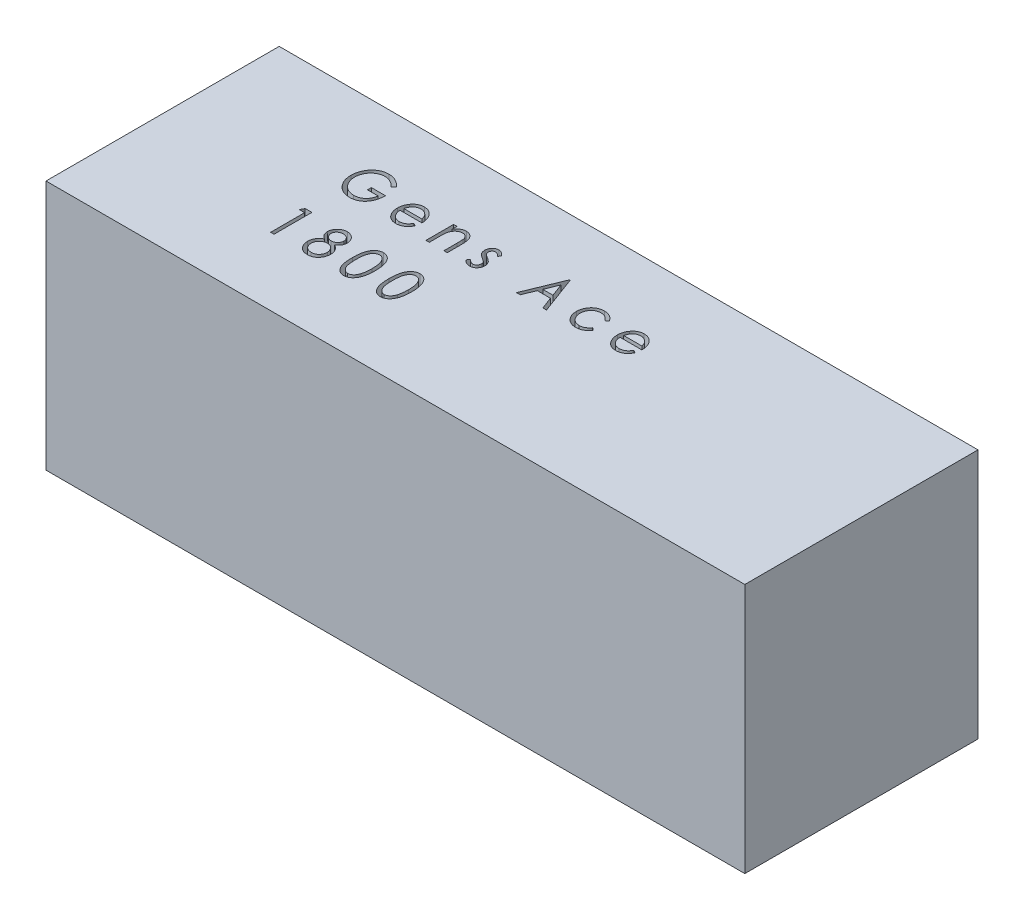
from build123d import *

# Parameters (mm, degrees)
SKETCH1_W           = 92.31
SKETCH1_H           = 30.8
BOSS_EXTRUDE1_DEPTH = 33.08
CUT_EXTRUDE1_DEPTH  = 15


with BuildPart() as part:
    # Sketch1 → Boss-Extrude1 (new body)
    with BuildSketch(Plane(origin=(0, 0, 0), x_dir=(1, 0, 0), z_dir=(0, 1, 0))):
        Rectangle(SKETCH1_W, SKETCH1_H)
    extrude(amount=BOSS_EXTRUDE1_DEPTH)

    # Sketch2 → Cut-Extrude1 (cut)
    # profile 1 of 11: a face of its own
    with BuildSketch(Plane(origin=(0, 33.08, 0), x_dir=(1, 0, 0), z_dir=(0, 1, 0))):
        with BuildLine():
            Line((-22.310087178, 7.047522333), (-22.648628845, 6.682938999))
            add(Edge.make_bspline(
                [(-22.648628845, 6.682938999), (-22.709227513, 6.748213092), (-22.828153596, 6.87631479), (-23.023250204, 7.045120984), (-23.227679982, 7.188180835), (-23.438655172, 7.306110342), (-23.651963638, 7.399593669), (-23.864575213, 7.465938686), (-24.074523651, 7.50879716), (-24.214272335, 7.513802155), (-24.28324423, 7.516272333)],
                knots=[0, 0, 0, 0, 1.131335406, 2.220268106, 3.271452375, 4.297255123, 5.287332592, 6.225418144, 7.124168701, 8, 8, 8, 8], degree=3))
            add(Edge.make_bspline(
                [(-24.28324423, 7.516272333), (-24.32535636, 7.515683535), (-24.409486443, 7.514507257), (-24.534554429, 7.499371757), (-24.658466401, 7.477708469), (-24.780681198, 7.44658772), (-24.901418188, 7.406176904), (-25.020639011, 7.357169594), (-25.138279108, 7.298630327), (-25.253490128, 7.231784381), (-25.365609196, 7.158514892), (-25.470693373, 7.076664401), (-25.570506742, 6.989837085), (-25.66251894, 6.895072846), (-25.748824052, 6.794739696), (-25.829468775, 6.688469059), (-25.902371458, 6.575079508), (-25.968264128, 6.456115876), (-26.026535806, 6.33333653), (-26.079904803, 6.208989201), (-26.121852629, 6.081567991), (-26.158875413, 5.953583036), (-26.185458389, 5.823178892), (-26.205632962, 5.69151946), (-26.218060567, 5.557709469), (-26.219579718, 5.468020875), (-26.220343589, 5.422922974)],
                knots=[0, 0, 0, 0, 0.957531822, 1.912922289, 2.862011677, 3.818126519, 4.778906464, 5.756414481, 6.748306359, 7.765809291, 8.7854363, 9.792709949, 10.793778567, 11.792828027, 12.794645581, 13.803350139, 14.825181505, 15.858773772, 16.894958351, 17.916281442, 18.934719513, 19.944681594, 20.945750212, 21.959816919, 22.974139614, 24, 24, 24, 24], degree=3))
            add(Edge.make_bspline(
                [(-26.220343589, 5.422922974), (-26.219694327, 5.376811628), (-26.218397885, 5.28473675), (-26.204188033, 5.147752655), (-26.185103364, 5.012059146), (-26.155232916, 4.878471356), (-26.1188013, 4.746040597), (-26.071901768, 4.616096184), (-26.019353736, 4.487135385), (-25.956944038, 4.361787772), (-25.888780955, 4.2397321), (-25.811928115, 4.124563055), (-25.73049761, 4.015149177), (-25.64105723, 3.913413081), (-25.546813444, 3.817245253), (-25.444672686, 3.729051988), (-25.337630537, 3.646654949), (-25.224588707, 3.571529846), (-25.106455132, 3.504943768), (-24.985540941, 3.445183995), (-24.861005124, 3.396400867), (-24.733805337, 3.356178587), (-24.604159051, 3.323641485), (-24.471391981, 3.302501988), (-24.336355133, 3.287132252), (-24.245228767, 3.286050552), (-24.199109614, 3.285503102)],
                knots=[0, 0, 0, 0, 1.014396523, 2.02554134, 3.028295436, 4.028488902, 5.035755334, 6.048980313, 7.066909895, 8.098719958, 9.128566039, 10.141391319, 11.143606878, 12.127885461, 13.120248603, 14.104527185, 15.095038902, 16.091555175, 17.088585988, 18.077706861, 19.057367231, 20.028698393, 21.012400885, 21.995664224, 22.985603477, 24, 24, 24, 24], degree=3))
            add(Edge.make_bspline(
                [(-24.199109614, 3.285503102), (-24.143956749, 3.286870497), (-24.035285913, 3.289564753), (-23.87546074, 3.310281018), (-23.721674106, 3.342697643), (-23.57485796, 3.390172213), (-23.434798008, 3.450745475), (-23.300804813, 3.523759329), (-23.174308345, 3.611906672), (-23.054476713, 3.711584678), (-22.943859133, 3.822240792), (-22.844144768, 3.941841045), (-22.756972863, 4.069470882), (-22.680982414, 4.204627985), (-22.618159317, 4.348068212), (-22.56710273, 4.499627494), (-22.526182558, 4.658517957), (-22.510391094, 4.768349792), (-22.502394871, 4.82396464)],
                knots=[0, 0, 0, 0, 1.051129639, 2.071100652, 3.067302124, 4.04351983, 5.007123942, 5.972764852, 6.947321263, 7.941528173, 8.940653207, 9.925896293, 10.905696917, 11.883075849, 12.877649407, 13.886036726, 14.929565851, 16, 16, 16, 16], degree=3))
            Line((-22.502394871, 4.82396464), (-23.912651281, 4.82396464))
            Line((-23.912651281, 4.82396464), (-23.912651281, 5.336785153))
            Line((-23.912651281, 5.336785153), (-22.053676922, 5.336785153))
            add(Edge.make_bspline(
                [(-22.053676922, 5.336785153), (-22.056104752, 5.241233324), (-22.060852054, 5.054394298), (-22.088724594, 4.781765504), (-22.135316754, 4.524019865), (-22.201902409, 4.282017399), (-22.284476608, 4.054147538), (-22.386877708, 3.84205896), (-22.508083331, 3.645358866), (-22.645536136, 3.464422512), (-22.798903001, 3.301806649), (-22.965760739, 3.159429034), (-23.146094233, 3.039559131), (-23.338927608, 2.942026833), (-23.543670106, 2.865119775), (-23.761157326, 2.811538471), (-23.991119271, 2.778864734), (-24.148585156, 2.774775155), (-24.229157691, 2.772682589)],
                knots=[0, 0, 0, 0, 1.210777789, 2.367516602, 3.468589441, 4.525646522, 5.54414491, 6.535575829, 7.504180693, 8.467040959, 9.40969031, 10.331064482, 11.240365786, 12.146591654, 13.063565696, 14.005445851, 14.979421581, 16, 16, 16, 16], degree=3))
            add(Edge.make_bspline(
                [(-24.229157691, 2.772682589), (-24.278592413, 2.773496743), (-24.376248305, 2.775105064), (-24.520646915, 2.786538238), (-24.661217465, 2.804001885), (-24.797824694, 2.83065044), (-24.930890877, 2.862965175), (-25.059468941, 2.904537455), (-25.184127304, 2.952856352), (-25.305560342, 3.007647532), (-25.422587738, 3.070751766), (-25.535236949, 3.141605148), (-25.644843393, 3.218424658), (-25.749738877, 3.303977219), (-25.851533768, 3.396145663), (-25.948246254, 3.497008776), (-26.042963773, 3.603404909), (-26.100972521, 3.679736755), (-26.130199358, 3.718195409)],
                knots=[0, 0, 0, 0, 1.073875762, 2.121389401, 3.145205683, 4.149514963, 5.14345099, 6.118334554, 7.082773847, 8.046831216, 9.010670274, 9.968651073, 10.936629604, 11.916492246, 12.907433166, 13.917930903, 14.950980736, 16, 16, 16, 16], degree=3))
            add(Edge.make_bspline(
                [(-26.130199358, 3.718195409), (-26.17342591, 3.779219808), (-26.259458081, 3.90067436), (-26.367342442, 4.095164538), (-26.462214692, 4.294843311), (-26.536522526, 4.50325212), (-26.596374349, 4.718024116), (-26.637625356, 4.940255023), (-26.665172712, 5.16915756), (-26.66775478, 5.32434978), (-26.669061537, 5.402890922)],
                knots=[0, 0, 0, 0, 0.996546363, 1.983388519, 2.961352749, 3.941584443, 4.929901843, 5.931448132, 6.953127772, 8, 8, 8, 8], degree=3))
            add(Edge.make_bspline(
                [(-26.669061537, 5.402890922), (-26.668026341, 5.461678309), (-26.66597068, 5.578416548), (-26.651720116, 5.752007004), (-26.627990594, 5.922313683), (-26.593248461, 6.089326844), (-26.550828172, 6.253478768), (-26.497140909, 6.414561534), (-26.434188746, 6.5723744), (-26.362160049, 6.726656457), (-26.281694714, 6.874926651), (-26.193236468, 7.015684547), (-26.097861683, 7.148112751), (-25.995964602, 7.273012152), (-25.88512206, 7.387784984), (-25.768709782, 7.495925699), (-25.644487277, 7.594999341), (-25.513082845, 7.685039107), (-25.376442818, 7.7661111), (-25.234852617, 7.836504148), (-25.088733895, 7.895623234), (-24.938736945, 7.945225988), (-24.78342333, 7.981927579), (-24.62416442, 8.008678301), (-24.460610871, 8.026824509), (-24.350066776, 8.028331889), (-24.294261858, 8.029092845)],
                knots=[0, 0, 0, 0, 1.07164269, 2.128036097, 3.172988306, 4.204309344, 5.236222884, 6.262087682, 7.297370218, 8.332062181, 9.364280816, 10.37073307, 11.360577134, 12.33782248, 13.306405567, 14.266923389, 15.232672116, 16.200030553, 17.16870925, 18.126832918, 19.079625504, 20.040066188, 21.004048815, 21.985643799, 22.983111838, 24, 24, 24, 24], degree=3))
            add(Edge.make_bspline(
                [(-24.294261858, 8.029092845), (-24.248835161, 8.028246273), (-24.1581859, 8.026556934), (-24.023426083, 8.015332464), (-23.890402983, 7.997106254), (-23.759452748, 7.972602348), (-23.63086051, 7.939075436), (-23.504237889, 7.89873338), (-23.379113729, 7.85222804), (-23.256282438, 7.796434857), (-23.13494717, 7.733189943), (-23.014319978, 7.662026931), (-22.894942514, 7.581299729), (-22.775765978, 7.492281403), (-22.657498345, 7.393906345), (-22.540628746, 7.286509042), (-22.423825706, 7.171078686), (-22.348486739, 7.089236514), (-22.310087178, 7.047522333)],
                knots=[0, 0, 0, 0, 0.953642326, 1.902999293, 2.83675562, 3.771511039, 4.698004985, 5.624578465, 6.56059437, 7.498576395, 8.454739615, 9.432017672, 10.437052158, 11.478597186, 12.553703354, 13.664985171, 14.809864987, 16, 16, 16, 16], degree=3))
        make_face()
    # profile 2 of 11: a face of its own
    with BuildSketch(Plane(origin=(0, 33.08, 0), x_dir=(1, 0, 0), z_dir=(0, 1, 0))):
        with BuildLine():
            Line((-17.006801922, 4.054733871), (-16.656241025, 3.845398935))
            add(Edge.make_bspline(
                [(-16.656241025, 3.845398935), (-16.685078525, 3.789151222), (-16.740973234, 3.680128263), (-16.836948767, 3.52913776), (-16.938324117, 3.394023544), (-17.04879129, 3.277237312), (-17.164885689, 3.174560753), (-17.288740705, 3.086777562), (-17.41852497, 3.009553737), (-17.556395853, 2.946182133), (-17.702462639, 2.896986113), (-17.857136854, 2.861935711), (-18.020826275, 2.840585842), (-18.133205063, 2.838071466), (-18.190696153, 2.836785153)],
                knots=[0, 0, 0, 0, 1.167114245, 2.262176366, 3.30081464, 4.282537276, 5.226511811, 6.159277954, 7.082699397, 8.012708801, 8.956683336, 9.924690737, 10.938306839, 12, 12, 12, 12], degree=3))
            add(Edge.make_bspline(
                [(-18.190696153, 2.836785153), (-18.254566167, 2.838420977), (-18.379233749, 2.841613934), (-18.560618222, 2.869282124), (-18.731123831, 2.914058159), (-18.890880793, 2.977692356), (-19.04015856, 3.059478353), (-19.179187751, 3.158852778), (-19.30632564, 3.277657308), (-19.42091208, 3.412498455), (-19.524343386, 3.557384879), (-19.613575315, 3.709652306), (-19.690420381, 3.866061874), (-19.752054687, 4.027905542), (-19.802110698, 4.193347942), (-19.835479386, 4.364181812), (-19.857488945, 4.539267012), (-19.860068829, 4.657964738), (-19.86136923, 4.717794768)],
                knots=[0, 0, 0, 0, 1.089842408, 2.127258295, 3.124062985, 4.093557742, 5.055179597, 6.023198866, 7.003225036, 8.017715973, 9.039402367, 10.038420736, 11.027471384, 12.010806785, 12.991843453, 13.974385654, 14.978981551, 16, 16, 16, 16], degree=3))
            add(Edge.make_bspline(
                [(-19.86136923, 4.717794768), (-19.860257703, 4.773936906), (-19.858055295, 4.885178452), (-19.839185955, 5.049480122), (-19.81052312, 5.209622778), (-19.769384669, 5.3650627), (-19.716236411, 5.515853598), (-19.650530447, 5.661684892), (-19.573813048, 5.80323049), (-19.513863603, 5.89278465), (-19.483765063, 5.937746692)],
                knots=[0, 0, 0, 0, 1.037955322, 2.056632653, 3.054552807, 4.044494995, 5.026763172, 6.007885755, 6.999828451, 8, 8, 8, 8], degree=3))
            add(Edge.make_bspline(
                [(-19.483765063, 5.937746692), (-19.443533787, 5.991790583), (-19.364641076, 6.097769554), (-19.229073363, 6.23707329), (-19.082999791, 6.354906768), (-18.927306962, 6.452125771), (-18.76009822, 6.526199231), (-18.583924343, 6.581317876), (-18.396772186, 6.612199373), (-18.268929121, 6.616594501), (-18.203716986, 6.618836435)],
                knots=[0, 0, 0, 0, 1.068622212, 2.095546368, 3.075529915, 4.04178896, 5.000167431, 5.970776925, 6.964903037, 8, 8, 8, 8], degree=3))
            add(Edge.make_bspline(
                [(-18.203716986, 6.618836435), (-18.136456918, 6.616894765), (-18.004375308, 6.613081819), (-17.811916321, 6.577877274), (-17.62984944, 6.521642118), (-17.458051154, 6.443183506), (-17.29728721, 6.340656683), (-17.147746659, 6.215032778), (-17.007073532, 6.068477546), (-16.92605812, 5.956817102), (-16.884606409, 5.899685794)],
                knots=[0, 0, 0, 0, 1.02844823, 2.019609899, 2.982709647, 3.938299943, 4.900667657, 5.891038968, 6.920945513, 8, 8, 8, 8], degree=3))
            add(Edge.make_bspline(
                [(-16.884606409, 5.899685794), (-16.856550786, 5.856361922), (-16.800238811, 5.769404212), (-16.727501491, 5.63039581), (-16.66829886, 5.482614913), (-16.61749176, 5.327895681), (-16.579071069, 5.16493808), (-16.549492514, 4.994455391), (-16.532883899, 4.815605201), (-16.529673368, 4.693787695), (-16.528035896, 4.631656948)],
                knots=[0, 0, 0, 0, 0.926188424, 1.859003396, 2.810515977, 3.780847052, 4.779433263, 5.812942849, 6.884532276, 8, 8, 8, 8], degree=3))
            Line((-16.528035896, 4.631656948), (-19.412651281, 4.631656948))
            add(Edge.make_bspline(
                [(-19.412651281, 4.631656948), (-19.410850515, 4.583507151), (-19.407310417, 4.488850217), (-19.387242026, 4.350714015), (-19.360037451, 4.218757331), (-19.320951426, 4.093838981), (-19.270006632, 3.976431459), (-19.211505096, 3.864263355), (-19.140361208, 3.759925453), (-19.06123423, 3.662103535), (-18.973075834, 3.574449147), (-18.880059603, 3.497070358), (-18.782103651, 3.430871539), (-18.678431123, 3.377772835), (-18.56961573, 3.336265235), (-18.455915456, 3.30779159), (-18.337572292, 3.288661881), (-18.256879432, 3.2865698), (-18.215736217, 3.285503102)],
                knots=[0, 0, 0, 0, 1.151599931, 2.26391235, 3.333562346, 4.371508358, 5.387476229, 6.39122723, 7.392243122, 8.402389321, 9.396117563, 10.360210576, 11.292566227, 12.217506855, 13.139928004, 14.071462678, 15.016688383, 16, 16, 16, 16], degree=3))
            add(Edge.make_bspline(
                [(-18.215736217, 3.285503102), (-18.17562076, 3.286401676), (-18.095400971, 3.288198575), (-17.975999554, 3.304763245), (-17.85848362, 3.332024402), (-17.743913638, 3.36891331), (-17.634152364, 3.414472239), (-17.532261012, 3.468714918), (-17.438253244, 3.528695923), (-17.351109937, 3.598263433), (-17.266091855, 3.682199674), (-17.182500972, 3.787286357), (-17.093360684, 3.912361035), (-17.036890374, 4.005244043), (-17.006801922, 4.054733871)],
                knots=[0, 0, 0, 0, 0.95518639, 1.910107873, 2.865062474, 3.825827943, 4.774069364, 5.691941798, 6.572140111, 7.426669854, 8.343335581, 9.411555122, 10.620827491, 12, 12, 12, 12], degree=3))
        make_face()
        with BuildLine():
            add(Edge.make_bspline(
                [(-16.976753845, 5.080374897), (-16.991024623, 5.139779543), (-17.018376229, 5.253635453), (-17.074927108, 5.412422057), (-17.139440291, 5.552837691), (-17.21480481, 5.67557881), (-17.301247779, 5.783637922), (-17.400226485, 5.879024473), (-17.511450607, 5.964344679), (-17.6351123, 6.03601351), (-17.765442939, 6.096474128), (-17.901916004, 6.138500739), (-18.04101027, 6.166007642), (-18.135479476, 6.1687488), (-18.182683332, 6.170118486)],
                knots=[0, 0, 0, 0, 1.241505033, 2.379488741, 3.421185839, 4.378263938, 5.300645251, 6.227214015, 7.166797336, 8.143630739, 9.127960369, 10.081275178, 11.04126208, 12, 12, 12, 12], degree=3))
            add(Edge.make_bspline(
                [(-18.182683332, 6.170118486), (-18.221463174, 6.16923968), (-18.298030672, 6.167504551), (-18.410569092, 6.151238483), (-18.518630796, 6.123468747), (-18.623423492, 6.087337652), (-18.722423287, 6.03687236), (-18.818909203, 5.979026157), (-18.910023484, 5.908431592), (-18.966390447, 5.854783704), (-18.994983012, 5.827570409)],
                knots=[0, 0, 0, 0, 1.026647746, 2.02702864, 3.002800722, 3.978853205, 4.955586324, 5.939775377, 6.954935579, 8, 8, 8, 8], degree=3))
            add(Edge.make_bspline(
                [(-18.994983012, 5.827570409), (-19.015469281, 5.805920942), (-19.057269673, 5.761747148), (-19.11261197, 5.686697447), (-19.166252256, 5.605568236), (-19.21543597, 5.515782899), (-19.259978111, 5.417806237), (-19.301013167, 5.312449222), (-19.338332969, 5.199405678), (-19.359608554, 5.120882558), (-19.370583973, 5.080374897)],
                knots=[0, 0, 0, 0, 0.844871503, 1.723884476, 2.640765681, 3.603098289, 4.624542049, 5.692238256, 6.809496755, 8, 8, 8, 8], degree=3))
            Line((-19.370583973, 5.080374897), (-16.976753845, 5.080374897))
        make_face(mode=Mode.SUBTRACT)
    # profile 3 of 11: a face of its own
    with BuildSketch(Plane(origin=(0, 33.08, 0), x_dir=(1, 0, 0), z_dir=(0, 1, 0))):
        with BuildLine():
            Line((-14.27162564, 6.554733871), (-13.822907691, 6.554733871))
            Line((-13.822907691, 6.554733871), (-13.822907691, 5.895679384))
            add(Edge.make_bspline(
                [(-13.822907691, 5.895679384), (-13.782047379, 5.955345566), (-13.703202123, 6.070479182), (-13.569698537, 6.222333509), (-13.429392533, 6.348526187), (-13.281899304, 6.449248338), (-13.126855174, 6.524575829), (-12.966223885, 6.57957358), (-12.798594831, 6.612366569), (-12.684561304, 6.616665981), (-12.62699423, 6.618836435)],
                knots=[0, 0, 0, 0, 1.185990827, 2.288522695, 3.3091407, 4.275672445, 5.209293633, 6.129359067, 7.055652052, 8, 8, 8, 8], degree=3))
            add(Edge.make_bspline(
                [(-12.62699423, 6.618836435), (-12.568690568, 6.616365835), (-12.454460405, 6.611525366), (-12.287988651, 6.572259628), (-12.132557147, 6.506433256), (-11.988812769, 6.415642669), (-11.859847377, 6.302926811), (-11.746116111, 6.172270073), (-11.654005986, 6.021216173), (-11.591059255, 5.882711708), (-11.549986217, 5.759187384), (-11.523256695, 5.653409003), (-11.501925541, 5.535145466), (-11.482368262, 5.405314531), (-11.469454013, 5.262802524), (-11.457742023, 5.108255558), (-11.452298979, 4.941524849), (-11.451516447, 4.826303887), (-11.451112819, 4.766873294)],
                knots=[0, 0, 0, 0, 1.12713107, 2.208306688, 3.288091974, 4.379562174, 5.483123014, 6.591569771, 7.717274597, 8.893962172, 9.527216441, 10.23381506, 11.002852221, 11.851542853, 12.773276241, 13.770613929, 14.85009001, 16, 16, 16, 16], degree=3))
            Line((-11.451112819, 4.766873294), (-11.451112819, 2.900887717))
            Line((-11.451112819, 2.900887717), (-11.899830768, 2.900887717))
            Line((-11.899830768, 2.900887717), (-11.899830768, 4.619637717))
            add(Edge.make_bspline(
                [(-11.899830768, 4.619637717), (-11.899637032, 4.66938522), (-11.899266443, 4.76454475), (-11.901780433, 4.900756916), (-11.903922858, 5.024280754), (-11.905045424, 5.134838277), (-11.909724927, 5.232292682), (-11.913362895, 5.316794606), (-11.917957208, 5.388310045), (-11.922735524, 5.431615661), (-11.924870832, 5.450967845)],
                knots=[0, 0, 0, 0, 1.434917939, 2.74478331, 3.929469464, 4.998608682, 5.933543807, 6.743407487, 7.438460572, 8, 8, 8, 8], degree=3))
            add(Edge.make_bspline(
                [(-11.924870832, 5.450967845), (-11.928333111, 5.480106191), (-11.935066555, 5.536774472), (-11.953880788, 5.617855417), (-11.975572534, 5.694152558), (-12.003213513, 5.764714615), (-12.036885291, 5.829519328), (-12.074532433, 5.889293378), (-12.119329483, 5.942104094), (-12.183058508, 6.006614237), (-12.275803892, 6.073575356), (-12.403827265, 6.129815085), (-12.547027451, 6.16474707), (-12.64781868, 6.168283641), (-12.700111217, 6.170118486)],
                knots=[0, 0, 0, 0, 0.89520826, 1.741001846, 2.537706727, 3.315672302, 4.049656644, 4.765001622, 5.467152629, 6.159092969, 7.531286849, 8.927463616, 10.405905707, 12, 12, 12, 12], degree=3))
            add(Edge.make_bspline(
                [(-12.700111217, 6.170118486), (-12.730870867, 6.169425342), (-12.792005073, 6.16804773), (-12.882661487, 6.154603149), (-12.970682503, 6.13229417), (-13.056869385, 6.102835348), (-13.13882, 6.061109615), (-13.220887206, 6.015077557), (-13.298487475, 5.957102741), (-13.373643219, 5.892308382), (-13.443475736, 5.820576777), (-13.509621266, 5.745600949), (-13.567416542, 5.664912305), (-13.619675227, 5.580619053), (-13.666047189, 5.492454752), (-13.705095606, 5.399506703), (-13.738183498, 5.302748709), (-13.755238991, 5.236084091), (-13.76381314, 5.202570409)],
                knots=[0, 0, 0, 0, 0.951900127, 1.891883031, 2.829532691, 3.761295011, 4.704398811, 5.672438705, 6.671067516, 7.696982975, 8.742244867, 9.768160327, 10.789587351, 11.810805132, 12.837241228, 13.870163147, 14.929286986, 16, 16, 16, 16], degree=3))
            add(Edge.make_bspline(
                [(-13.76381314, 5.202570409), (-13.768755563, 5.177909566), (-13.779526464, 5.12416679), (-13.790771912, 5.036144485), (-13.80093858, 4.934285639), (-13.808207707, 4.818662333), (-13.815970298, 4.689167838), (-13.81895662, 4.545858289), (-13.822523013, 4.388618638), (-13.822775874, 4.279095783), (-13.822907691, 4.222001499)],
                knots=[0, 0, 0, 0, 0.613436715, 1.336847711, 2.163535168, 3.110622441, 4.162898823, 5.328117746, 6.607147298, 8, 8, 8, 8], degree=3))
            Line((-13.822907691, 4.222001499), (-13.822907691, 2.900887717))
            Line((-13.822907691, 2.900887717), (-14.27162564, 2.900887717))
            Line((-14.27162564, 2.900887717), (-14.27162564, 6.554733871))
        make_face()
    # profile 4 of 11: a face of its own
    with BuildSketch(Plane(origin=(0, 33.08, 0), x_dir=(1, 0, 0), z_dir=(0, 1, 0))):
        with BuildLine():
            Line((-7.463933332, 6.099004704), (-7.731361217, 5.785503102))
            add(Edge.make_bspline(
                [(-7.731361217, 5.785503102), (-7.756966499, 5.815939501), (-7.806287691, 5.874566449), (-7.884597161, 5.9530581), (-7.962635398, 6.01896263), (-8.039236339, 6.074627735), (-8.116465545, 6.116707533), (-8.193338628, 6.14743855), (-8.269968927, 6.166459617), (-8.321205295, 6.168914138), (-8.346345191, 6.170118486)],
                knots=[0, 0, 0, 0, 1.274491163, 2.454939727, 3.548361497, 4.546055419, 5.484665757, 6.359036529, 7.194836563, 8, 8, 8, 8], degree=3))
            add(Edge.make_bspline(
                [(-8.346345191, 6.170118486), (-8.377309882, 6.16858307), (-8.438252381, 6.165561173), (-8.525471699, 6.135365762), (-8.606215206, 6.088976955), (-8.676048702, 6.023416372), (-8.734265386, 5.947409995), (-8.779199336, 5.864017657), (-8.804572197, 5.772932481), (-8.808229509, 5.710197037), (-8.810087178, 5.678331627)],
                knots=[0, 0, 0, 0, 0.989879031, 1.948209371, 2.927138591, 3.957933439, 4.996707036, 5.988206544, 6.978143495, 8, 8, 8, 8], degree=3))
            add(Edge.make_bspline(
                [(-8.810087178, 5.678331627), (-8.808762727, 5.6494858), (-8.806124093, 5.592017798), (-8.783771851, 5.50702343), (-8.747493584, 5.424446533), (-8.714027698, 5.373080665), (-8.696906089, 5.346801179)],
                knots=[0, 0, 0, 0, 0.97148553, 1.935438782, 2.943742038, 4, 4, 4, 4], degree=3))
            add(Edge.make_bspline(
                [(-8.696906089, 5.346801179), (-8.686516262, 5.332862452), (-8.664539924, 5.303379557), (-8.623115158, 5.261629132), (-8.57570476, 5.216376202), (-8.518980631, 5.170962478), (-8.456143912, 5.122332525), (-8.384131498, 5.073773301), (-8.30567852, 5.021266992), (-8.249352175, 4.987637641), (-8.220143268, 4.970198615)],
                knots=[0, 0, 0, 0, 0.681875089, 1.442287477, 2.304898459, 3.255029591, 4.293415614, 5.424424514, 6.664395041, 8, 8, 8, 8], degree=3))
            add(Edge.make_bspline(
                [(-8.220143268, 4.970198615), (-8.184609388, 4.948392506), (-8.115847572, 4.906195379), (-8.018301633, 4.841153108), (-7.930258089, 4.776056136), (-7.850580327, 4.711722795), (-7.77953735, 4.648329889), (-7.717938914, 4.584476373), (-7.664379616, 4.522015741), (-7.634519294, 4.478344632), (-7.620183332, 4.457378102)],
                knots=[0, 0, 0, 0, 1.25757375, 2.433538206, 3.535360318, 4.559312813, 5.521998164, 6.405171035, 7.23432147, 8, 8, 8, 8], degree=3))
            add(Edge.make_bspline(
                [(-7.620183332, 4.457378102), (-7.596164568, 4.414932551), (-7.54818075, 4.330136366), (-7.499591577, 4.191047011), (-7.469621027, 4.04434193), (-7.465851984, 3.94370435), (-7.463933332, 3.892474256)],
                knots=[0, 0, 0, 0, 0.984436973, 1.96667253, 2.964923853, 4, 4, 4, 4], degree=3))
            add(Edge.make_bspline(
                [(-7.463933332, 3.892474256), (-7.464610033, 3.856378173), (-7.465942994, 3.785276397), (-7.479273524, 3.680638317), (-7.501418712, 3.58053335), (-7.531264156, 3.483895567), (-7.571890626, 3.392618461), (-7.618729344, 3.303952807), (-7.676572336, 3.221163914), (-7.741005512, 3.142603459), (-7.81146352, 3.070448224), (-7.887884357, 3.008199532), (-7.96881552, 2.955463931), (-8.054247735, 2.912477519), (-8.143694715, 2.877992948), (-8.237785133, 2.853877406), (-8.336236845, 2.839831754), (-8.403391529, 2.837811161), (-8.437491025, 2.836785153)],
                knots=[0, 0, 0, 0, 1.081143338, 2.129627527, 3.153923255, 4.150537551, 5.154106393, 6.143312689, 7.150564364, 8.173980407, 9.185544752, 10.166726343, 11.121230842, 12.074161375, 13.027249422, 13.988076077, 14.978394579, 16, 16, 16, 16], degree=3))
            add(Edge.make_bspline(
                [(-8.437491025, 2.836785153), (-8.483350827, 2.838219611), (-8.574762579, 2.841078899), (-8.709897845, 2.867507088), (-8.841969728, 2.908692663), (-8.969785742, 2.965685089), (-9.09070667, 3.03735538), (-9.201228266, 3.123236199), (-9.301798232, 3.220524742), (-9.358505247, 3.294427832), (-9.387010255, 3.33157682)],
                knots=[0, 0, 0, 0, 0.989573484, 1.972504045, 2.962313952, 3.972686715, 4.987987903, 5.990404037, 6.989833111, 8, 8, 8, 8], degree=3))
            Line((-9.387010255, 3.33157682), (-9.124590384, 3.670118486))
            add(Edge.make_bspline(
                [(-9.124590384, 3.670118486), (-9.099683517, 3.639665666), (-9.051602027, 3.580877982), (-8.974168963, 3.502051155), (-8.895033837, 3.43606757), (-8.8154291, 3.380686055), (-8.734153032, 3.338630695), (-8.651908241, 3.307795871), (-8.568213507, 3.289025536), (-8.511701327, 3.286673931), (-8.483564743, 3.285503102)],
                knots=[0, 0, 0, 0, 1.219430901, 2.354051827, 3.419706558, 4.410314163, 5.35484724, 6.249024396, 7.128214957, 8, 8, 8, 8], degree=3))
            add(Edge.make_bspline(
                [(-8.483564743, 3.285503102), (-8.445221269, 3.287458182), (-8.370029452, 3.291292109), (-8.262541174, 3.326629008), (-8.162937574, 3.380882576), (-8.077840691, 3.459068336), (-8.004003022, 3.548515402), (-7.952211592, 3.650258076), (-7.917352497, 3.759006556), (-7.914239956, 3.834772193), (-7.912651281, 3.873443807)],
                knots=[0, 0, 0, 0, 1.009821182, 1.98026635, 2.959126574, 3.983508551, 5.012131667, 6.005928159, 6.982203798, 8, 8, 8, 8], degree=3))
            add(Edge.make_bspline(
                [(-7.912651281, 3.873443807), (-7.913942976, 3.905288211), (-7.916487856, 3.968027609), (-7.938342614, 4.058992306), (-7.973326389, 4.144965699), (-8.007540984, 4.196140934), (-8.024830768, 4.222001499)],
                knots=[0, 0, 0, 0, 1.025273956, 2.019980326, 2.999429558, 4, 4, 4, 4], degree=3))
            add(Edge.make_bspline(
                [(-8.024830768, 4.222001499), (-8.03525254, 4.234928019), (-8.057987303, 4.263126811), (-8.100733198, 4.303134052), (-8.150502575, 4.347276043), (-8.20910017, 4.393776982), (-8.277156713, 4.441122212), (-8.353733904, 4.4914037), (-8.438911102, 4.544478175), (-8.499177443, 4.580039127), (-8.530640063, 4.598604063)],
                knots=[0, 0, 0, 0, 0.628055649, 1.370083424, 2.21210131, 3.147971961, 4.200247531, 5.350348024, 6.616723807, 8, 8, 8, 8], degree=3))
            add(Edge.make_bspline(
                [(-8.530640063, 4.598604063), (-8.564877787, 4.619346074), (-8.631194925, 4.659522542), (-8.724503241, 4.72263214), (-8.808633159, 4.78601815), (-8.885219066, 4.848032501), (-8.953591788, 4.909782688), (-9.012844588, 4.972313874), (-9.064433415, 5.033775387), (-9.092901248, 5.076770795), (-9.106561537, 5.09740214)],
                knots=[0, 0, 0, 0, 1.250050915, 2.421299963, 3.51612139, 4.53880554, 5.498304292, 6.39070068, 7.22777776, 8, 8, 8, 8], degree=3))
            add(Edge.make_bspline(
                [(-9.106561537, 5.09740214), (-9.129887844, 5.139200379), (-9.176872866, 5.2233925), (-9.224055903, 5.361498779), (-9.253015056, 5.508182744), (-9.256842774, 5.608746729), (-9.258805127, 5.660302781)],
                knots=[0, 0, 0, 0, 0.971476482, 1.956796919, 2.952512816, 4, 4, 4, 4], degree=3))
            add(Edge.make_bspline(
                [(-9.258805127, 5.660302781), (-9.25811022, 5.694069029), (-9.256750188, 5.760154359), (-9.243888044, 5.856848231), (-9.225731838, 5.949728272), (-9.197032691, 6.037587203), (-9.162319901, 6.121984067), (-9.117462713, 6.200825971), (-9.066745988, 6.276587563), (-9.00734927, 6.346120124), (-8.943120203, 6.410457599), (-8.87246518, 6.465136773), (-8.798797829, 6.513170874), (-8.720554172, 6.552231382), (-8.637913566, 6.582566491), (-8.551132627, 6.6031712), (-8.460633942, 6.616931789), (-8.398814821, 6.618194385), (-8.367378845, 6.618836435)],
                knots=[0, 0, 0, 0, 1.10620448, 2.164998892, 3.193088745, 4.203730674, 5.189536131, 6.179161261, 7.171747086, 8.173640765, 9.171941698, 10.146198287, 11.096369312, 12.050753697, 13.006329535, 13.975161903, 14.970338632, 16, 16, 16, 16], degree=3))
            add(Edge.make_bspline(
                [(-8.367378845, 6.618836435), (-8.329864277, 6.617257598), (-8.254081004, 6.614068185), (-8.140410122, 6.588733047), (-8.026937348, 6.547088913), (-7.91333707, 6.48958167), (-7.800509179, 6.415168349), (-7.687367061, 6.32526921), (-7.572509308, 6.22041405), (-7.500964471, 6.140412818), (-7.463933332, 6.099004704)],
                knots=[0, 0, 0, 0, 0.837632011, 1.69210253, 2.588837465, 3.532972928, 4.530279989, 5.603306399, 6.759487077, 8, 8, 8, 8], degree=3))
        make_face()
    # profile 5 of 11: a face of its own
    with BuildSketch(Plane(origin=(0, 33.08, 0), x_dir=(1, 0, 0), z_dir=(0, 1, 0))):
        Polygon((-0.194702563, 7.900887717), (1.664271796, 2.900887717), (1.17749295, 2.900887717), (0.582541027, 4.50345182), (-1.15824423, 4.50345182), (-1.815295512, 2.900887717), (-2.310087178, 2.900887717), (-0.258805127, 7.900887717), align=None)
        Polygon((-0.244782691, 6.728011115), (-0.946906089, 5.016272333), (0.391234937, 5.016272333), align=None, mode=Mode.SUBTRACT)
    # profile 6 of 11: a face of its own
    with BuildSketch(Plane(origin=(0, 33.08, 0), x_dir=(1, 0, 0), z_dir=(0, 1, 0))):
        with BuildLine():
            Line((7.061707693, 5.762466243), (6.73218045, 5.529092845))
            add(Edge.make_bspline(
                [(6.73218045, 5.529092845), (6.69657989, 5.580048791), (6.627248543, 5.679284432), (6.506854266, 5.810145868), (6.37798779, 5.921924865), (6.238523826, 6.012978646), (6.089162058, 6.08356595), (5.930190454, 6.133847197), (5.761818077, 6.164647994), (5.646241329, 6.168271907), (5.587348719, 6.170118486)],
                knots=[0, 0, 0, 0, 1.086016331, 2.114994175, 3.100362948, 4.062274699, 5.018143114, 5.980143454, 6.970773729, 8, 8, 8, 8], degree=3))
            add(Edge.make_bspline(
                [(5.587348719, 6.170118486), (5.53988246, 6.168647527), (5.446900357, 6.165766051), (5.310112794, 6.14672448), (5.180097384, 6.113328845), (5.055412293, 6.068448319), (4.937730306, 6.008696289), (4.826339117, 5.936018573), (4.719998858, 5.851488515), (4.62233956, 5.753572075), (4.532192456, 5.647675804), (4.455384451, 5.533424261), (4.388032474, 5.415225143), (4.335599914, 5.29005979), (4.292764075, 5.160287292), (4.263050067, 5.02436928), (4.244525057, 4.882905513), (4.242315102, 4.786629349), (4.241194873, 4.73782682)],
                knots=[0, 0, 0, 0, 1.038917621, 2.035145499, 3.015242894, 3.972323305, 4.929849959, 5.896672532, 6.879272957, 7.897213818, 8.91892465, 9.918149674, 10.906142566, 11.891564845, 12.882929966, 13.89350007, 14.932212077, 16, 16, 16, 16], degree=3))
            add(Edge.make_bspline(
                [(4.241194873, 4.73782682), (4.243257442, 4.673910276), (4.247345966, 4.547211851), (4.281860763, 4.360240715), (4.336960479, 4.178959407), (4.413743176, 4.005791393), (4.509290054, 3.844557457), (4.622703508, 3.70025663), (4.753419142, 3.575704557), (4.899125081, 3.471385951), (5.057584446, 3.387572414), (5.227121028, 3.328591759), (5.405852822, 3.292253949), (5.528080354, 3.287781666), (5.590353527, 3.285503102)],
                knots=[0, 0, 0, 0, 1.040478479, 2.062486137, 3.086098736, 4.120919107, 5.140362306, 6.131576321, 7.100945709, 8.071397672, 9.042032486, 10.010409723, 10.986332318, 12, 12, 12, 12], degree=3))
            add(Edge.make_bspline(
                [(5.590353527, 3.285503102), (5.647589054, 3.287321361), (5.759875575, 3.290888482), (5.924110169, 3.32224784), (6.080265085, 3.371928494), (6.228083433, 3.443443254), (6.368161295, 3.533782763), (6.498872198, 3.645973374), (6.623267061, 3.77606257), (6.695259518, 3.875521686), (6.73218045, 3.926528743)],
                knots=[0, 0, 0, 0, 1.004585578, 1.970828681, 2.925990997, 3.875573487, 4.846734251, 5.845465141, 6.895058739, 8, 8, 8, 8], degree=3))
            Line((6.73218045, 3.926528743), (7.061707693, 3.680134512))
            add(Edge.make_bspline(
                [(7.061707693, 3.680134512), (7.042076507, 3.647493722), (7.003057086, 3.582616098), (6.937877119, 3.490516599), (6.867642917, 3.404457844), (6.793065268, 3.323475624), (6.713110324, 3.248411521), (6.627494917, 3.179638042), (6.538312331, 3.114549693), (6.443260966, 3.057415662), (6.345046056, 3.00466892), (6.242538045, 2.95959435), (6.136659963, 2.921843668), (6.027674837, 2.890416414), (5.915215128, 2.866322218), (5.7990428, 2.849943321), (5.679746579, 2.837902406), (5.599065333, 2.837160162), (5.558302245, 2.836785153)],
                knots=[0, 0, 0, 0, 1.009715232, 2.006934473, 2.988589463, 3.953333372, 4.924110406, 5.893311928, 6.863765989, 7.849126327, 8.831260211, 9.81820997, 10.815075497, 11.809776702, 12.823790509, 13.861675719, 14.919641121, 16, 16, 16, 16], degree=3))
            add(Edge.make_bspline(
                [(5.558302245, 2.836785153), (5.496098369, 2.838073539), (5.373789934, 2.84060683), (5.194765303, 2.868058249), (5.023383309, 2.909502149), (4.860190432, 2.969092167), (4.705122735, 3.045284517), (4.558901785, 3.139784371), (4.420166744, 3.250000333), (4.292138657, 3.376997715), (4.175424309, 3.515423631), (4.073155816, 3.662659032), (3.986209325, 3.817220948), (3.914605175, 3.979071306), (3.859739927, 4.148664911), (3.820450861, 4.32535529), (3.797195215, 4.509172032), (3.794065641, 4.634261516), (3.792476924, 4.697762717)],
                knots=[0, 0, 0, 0, 1.041964293, 2.048763382, 3.02882405, 3.993762226, 4.954911118, 5.919021154, 6.906722743, 7.91987981, 8.936740174, 9.938126702, 10.920438056, 11.905249441, 12.899935137, 13.903399671, 14.935668814, 16, 16, 16, 16], degree=3))
            add(Edge.make_bspline(
                [(3.792476924, 4.697762717), (3.793297849, 4.740857443), (3.794929608, 4.826517146), (3.806465908, 4.953889146), (3.823778726, 5.079168039), (3.850864378, 5.201543723), (3.881844457, 5.32255712), (3.923868695, 5.440025008), (3.970503263, 5.556218889), (4.025874193, 5.668538082), (4.086031621, 5.777526303), (4.153979099, 5.880158467), (4.226546383, 5.977129172), (4.305149486, 6.067566105), (4.388427405, 6.15190024), (4.476858054, 6.230503528), (4.571296041, 6.30275041), (4.67113481, 6.368494955), (4.775069702, 6.427661509), (4.882540056, 6.478808061), (4.99323088, 6.522363089), (5.107350164, 6.5566479), (5.223782439, 6.585712821), (5.343858372, 6.603882258), (5.466547355, 6.616644416), (5.54958778, 6.618102868), (5.591355129, 6.618836435)],
                knots=[0, 0, 0, 0, 1.056485037, 2.099983083, 3.133771558, 4.154875033, 5.171506307, 6.194085247, 7.21104603, 8.239798815, 9.262279457, 10.261257752, 11.25502398, 12.229933516, 13.19659456, 14.159191868, 15.128448909, 16.109251675, 17.088036926, 18.05833042, 19.025130093, 20.001310363, 20.978142529, 21.964599563, 22.976242219, 24, 24, 24, 24], degree=3))
            add(Edge.make_bspline(
                [(5.591355129, 6.618836435), (5.644184209, 6.617538332), (5.749261526, 6.6149564), (5.904982346, 6.592659593), (6.058211937, 6.5594327), (6.206459061, 6.509588607), (6.348146945, 6.450469808), (6.480475232, 6.382286861), (6.601014341, 6.304900632), (6.711492105, 6.218942692), (6.812834737, 6.123250397), (6.904289899, 6.014530358), (6.988978791, 5.894466915), (7.037151052, 5.807035775), (7.061707693, 5.762466243)],
                knots=[0, 0, 0, 0, 1.061534631, 2.111397946, 3.156832074, 4.209609302, 5.250487199, 6.241159584, 7.198153735, 8.125914841, 9.051707233, 9.994496909, 10.977660202, 12, 12, 12, 12], degree=3))
        make_face()
    # profile 7 of 11: a face of its own
    with BuildSketch(Plane(origin=(0, 33.08, 0), x_dir=(1, 0, 0), z_dir=(0, 1, 0))):
        with BuildLine():
            Line((12.044480129, 4.054733871), (12.395041027, 3.845398935))
            add(Edge.make_bspline(
                [(12.395041027, 3.845398935), (12.366203527, 3.789151222), (12.310308817, 3.680128263), (12.214333284, 3.52913776), (12.112957934, 3.394023544), (12.002490761, 3.277237312), (11.886396363, 3.174560753), (11.762541347, 3.086777562), (11.632757081, 3.009553737), (11.494886198, 2.946182133), (11.348819413, 2.896986113), (11.194145198, 2.861935711), (11.030455776, 2.840585842), (10.918076988, 2.838071466), (10.860585898, 2.836785153)],
                knots=[0, 0, 0, 0, 1.167114245, 2.262176366, 3.30081464, 4.282537276, 5.226511811, 6.159277954, 7.082699397, 8.012708801, 8.956683336, 9.924690737, 10.938306839, 12, 12, 12, 12], degree=3))
            add(Edge.make_bspline(
                [(10.860585898, 2.836785153), (10.796715884, 2.838420977), (10.672048303, 2.841613934), (10.490663829, 2.869282124), (10.320158221, 2.914058159), (10.160401258, 2.977692356), (10.011123492, 3.059478353), (9.8720943, 3.158852778), (9.744956411, 3.277657308), (9.630369971, 3.412498455), (9.526938665, 3.557384879), (9.437706736, 3.709652306), (9.36086167, 3.866061874), (9.299227364, 4.027905542), (9.249171354, 4.193347942), (9.215802665, 4.364181812), (9.193793106, 4.539267012), (9.191213222, 4.657964738), (9.189912822, 4.717794768)],
                knots=[0, 0, 0, 0, 1.089842408, 2.127258295, 3.124062985, 4.093557742, 5.055179597, 6.023198866, 7.003225036, 8.017715973, 9.039402367, 10.038420736, 11.027471384, 12.010806785, 12.991843453, 13.974385654, 14.978981551, 16, 16, 16, 16], degree=3))
            add(Edge.make_bspline(
                [(9.189912822, 4.717794768), (9.191024348, 4.773936906), (9.193226757, 4.885178452), (9.212096097, 5.049480122), (9.240758931, 5.209622778), (9.281897382, 5.3650627), (9.33504564, 5.515853598), (9.400751604, 5.661684892), (9.477469003, 5.80323049), (9.537418449, 5.89278465), (9.567516988, 5.937746692)],
                knots=[0, 0, 0, 0, 1.037955322, 2.056632653, 3.054552807, 4.044494995, 5.026763172, 6.007885755, 6.999828451, 8, 8, 8, 8], degree=3))
            add(Edge.make_bspline(
                [(9.567516988, 5.937746692), (9.607748264, 5.991790583), (9.686640975, 6.097769554), (9.822208688, 6.23707329), (9.96828226, 6.354906768), (10.123975089, 6.452125771), (10.291183831, 6.526199231), (10.467357708, 6.581317876), (10.654509865, 6.612199373), (10.78235293, 6.616594501), (10.847565065, 6.618836435)],
                knots=[0, 0, 0, 0, 1.068622212, 2.095546368, 3.075529915, 4.04178896, 5.000167431, 5.970776925, 6.964903037, 8, 8, 8, 8], degree=3))
            add(Edge.make_bspline(
                [(10.847565065, 6.618836435), (10.914825133, 6.616894765), (11.046906743, 6.613081819), (11.23936573, 6.577877274), (11.421432611, 6.521642118), (11.593230897, 6.443183506), (11.753994841, 6.340656683), (11.903535392, 6.215032778), (12.04420852, 6.068477546), (12.125223931, 5.956817102), (12.166675642, 5.899685794)],
                knots=[0, 0, 0, 0, 1.02844823, 2.019609899, 2.982709647, 3.938299943, 4.900667657, 5.891038968, 6.920945513, 8, 8, 8, 8], degree=3))
            add(Edge.make_bspline(
                [(12.166675642, 5.899685794), (12.194731265, 5.856361922), (12.25104324, 5.769404212), (12.323780561, 5.63039581), (12.382983192, 5.482614913), (12.433790292, 5.327895681), (12.472210983, 5.16493808), (12.501789538, 4.994455391), (12.518398153, 4.815605201), (12.521608683, 4.693787695), (12.523246155, 4.631656948)],
                knots=[0, 0, 0, 0, 0.926188424, 1.859003396, 2.810515977, 3.780847052, 4.779433263, 5.812942849, 6.884532276, 8, 8, 8, 8], degree=3))
            Line((12.523246155, 4.631656948), (9.63863077, 4.631656948))
            add(Edge.make_bspline(
                [(9.63863077, 4.631656948), (9.640431536, 4.583507151), (9.643971634, 4.488850217), (9.664040025, 4.350714015), (9.6912446, 4.218757331), (9.730330625, 4.093838981), (9.78127542, 3.976431459), (9.839776955, 3.864263355), (9.910920843, 3.759925453), (9.990047821, 3.662103535), (10.078206217, 3.574449147), (10.171222449, 3.497070358), (10.269178401, 3.430871539), (10.372850928, 3.377772835), (10.481666321, 3.336265235), (10.595366596, 3.30779159), (10.713709759, 3.288661881), (10.794402619, 3.2865698), (10.835545834, 3.285503102)],
                knots=[0, 0, 0, 0, 1.151599931, 2.26391235, 3.333562346, 4.371508358, 5.387476229, 6.39122723, 7.392243122, 8.402389321, 9.396117563, 10.360210576, 11.292566227, 12.217506855, 13.139928004, 14.071462678, 15.016688383, 16, 16, 16, 16], degree=3))
            add(Edge.make_bspline(
                [(10.835545834, 3.285503102), (10.875661292, 3.286401676), (10.955881081, 3.288198575), (11.075282497, 3.304763245), (11.192798431, 3.332024402), (11.307368414, 3.36891331), (11.417129687, 3.414472239), (11.519021039, 3.468714918), (11.613028807, 3.528695923), (11.700172114, 3.598263433), (11.785190196, 3.682199674), (11.868781079, 3.787286357), (11.957921368, 3.912361035), (12.014391677, 4.005244043), (12.044480129, 4.054733871)],
                knots=[0, 0, 0, 0, 0.95518639, 1.910107873, 2.865062474, 3.825827943, 4.774069364, 5.691941798, 6.572140111, 7.426669854, 8.343335581, 9.411555122, 10.620827491, 12, 12, 12, 12], degree=3))
        make_face()
        with BuildLine():
            add(Edge.make_bspline(
                [(12.074528206, 5.080374897), (12.060257428, 5.139779543), (12.032905822, 5.253635453), (11.976354943, 5.412422057), (11.91184176, 5.552837691), (11.836477242, 5.67557881), (11.750034273, 5.783637922), (11.651055566, 5.879024473), (11.539831444, 5.964344679), (11.416169751, 6.03601351), (11.285839112, 6.096474128), (11.149366047, 6.138500739), (11.010271781, 6.166007642), (10.915802575, 6.1687488), (10.868598719, 6.170118486)],
                knots=[0, 0, 0, 0, 1.241505033, 2.379488741, 3.421185839, 4.378263938, 5.300645251, 6.227214015, 7.166797336, 8.143630739, 9.127960369, 10.081275178, 11.04126208, 12, 12, 12, 12], degree=3))
            add(Edge.make_bspline(
                [(10.868598719, 6.170118486), (10.829818877, 6.16923968), (10.753251379, 6.167504551), (10.640712959, 6.151238483), (10.532651255, 6.123468747), (10.427858559, 6.087337652), (10.328858765, 6.03687236), (10.232372848, 5.979026157), (10.141258567, 5.908431592), (10.084891605, 5.854783704), (10.05629904, 5.827570409)],
                knots=[0, 0, 0, 0, 1.026647746, 2.02702864, 3.002800722, 3.978853205, 4.955586324, 5.939775377, 6.954935579, 8, 8, 8, 8], degree=3))
            add(Edge.make_bspline(
                [(10.05629904, 5.827570409), (10.035812771, 5.805920942), (9.994012378, 5.761747148), (9.938670081, 5.686697447), (9.885029795, 5.605568236), (9.835846082, 5.515782899), (9.79130394, 5.417806237), (9.750268884, 5.312449222), (9.712949082, 5.199405678), (9.691673497, 5.120882558), (9.680698078, 5.080374897)],
                knots=[0, 0, 0, 0, 0.844871503, 1.723884476, 2.640765681, 3.603098289, 4.624542049, 5.692238256, 6.809496755, 8, 8, 8, 8], degree=3))
            Line((9.680698078, 5.080374897), (12.074528206, 5.080374897))
        make_face(mode=Mode.SUBTRACT)
    # profile 8 of 11: a face of its own
    with BuildSketch(Plane(origin=(0, 33.08, 0), x_dir=(1, 0, 0), z_dir=(0, 1, 0))):
        Polygon((-25.887811537, -1.432445616), (-25.002394871, -1.432445616), (-25.002394871, -6.432445616), (-25.451112819, -6.432445616), (-25.451112819, -1.945266129), (-26.156241025, -1.945266129), align=None)
    # profile 9 of 11: a face of its own
    with BuildSketch(Plane(origin=(0, 33.08, 0), x_dir=(1, 0, 0), z_dir=(0, 1, 0))):
        with BuildLine():
            add(Edge.make_bspline(
                [(-19.781241025, -3.646988885), (-19.74526717, -3.668289363), (-19.675181975, -3.709787506), (-19.57629475, -3.777532714), (-19.485753738, -3.847544395), (-19.401653721, -3.918189693), (-19.327326918, -3.99319879), (-19.26039415, -4.069557648), (-19.201554008, -4.14868082), (-19.133818369, -4.256369161), (-19.064743376, -4.398961874), (-19.006638595, -4.581428458), (-18.970671252, -4.77505281), (-18.966209869, -4.908182569), (-18.963933332, -4.976115488)],
                knots=[0, 0, 0, 0, 0.914362454, 1.781384597, 2.619883779, 3.417600481, 4.181920405, 4.927374046, 5.637276055, 6.336350791, 7.708254165, 9.089438062, 10.514810145, 12, 12, 12, 12], degree=3))
            add(Edge.make_bspline(
                [(-18.963933332, -4.976115488), (-18.964770897, -5.024243606), (-18.966427568, -5.11943917), (-18.98339463, -5.259991577), (-19.008661311, -5.396535735), (-19.046629882, -5.528548784), (-19.092984474, -5.656489934), (-19.151136712, -5.77984884), (-19.218477582, -5.899460991), (-19.272365882, -5.974187296), (-19.299470191, -6.011772539)],
                knots=[0, 0, 0, 0, 1.041882803, 2.060804048, 3.06202158, 4.046332822, 5.03231592, 6.006025776, 6.99708666, 8, 8, 8, 8], degree=3))
            add(Edge.make_bspline(
                [(-19.299470191, -6.011772539), (-19.334487917, -6.055443587), (-19.403827283, -6.141917586), (-19.524860525, -6.253887998), (-19.656254349, -6.349238944), (-19.798917446, -6.427151765), (-19.9529054, -6.486929525), (-20.117766346, -6.530505388), (-20.293649655, -6.555180867), (-20.414512474, -6.558799323), (-20.476353204, -6.560650744)],
                knots=[0, 0, 0, 0, 0.994201578, 1.968640301, 2.92098468, 3.874697238, 4.850310626, 5.851048309, 6.900466311, 8, 8, 8, 8], degree=3))
            add(Edge.make_bspline(
                [(-20.476353204, -6.560650744), (-20.536178058, -6.559022411), (-20.652243252, -6.555863308), (-20.821206992, -6.533992723), (-20.978495275, -6.495789612), (-21.125536958, -6.444053955), (-21.260665765, -6.375339242), (-21.384460234, -6.291535763), (-21.498247344, -6.193740148), (-21.597915775, -6.080480465), (-21.686088423, -5.958897309), (-21.763403557, -5.833143904), (-21.83037786, -5.70511737), (-21.88301123, -5.572897129), (-21.926111935, -5.438624316), (-21.954306444, -5.30053458), (-21.973455316, -5.159945208), (-21.975649259, -5.064988922), (-21.976753845, -5.017181193)],
                knots=[0, 0, 0, 0, 1.189830096, 2.308369381, 3.38102576, 4.403937896, 5.401777142, 6.387120394, 7.37100814, 8.377427796, 9.380226239, 10.35513181, 11.31145126, 12.249850496, 13.182357426, 14.112259914, 15.049577746, 16, 16, 16, 16], degree=3))
            add(Edge.make_bspline(
                [(-21.976753845, -5.017181193), (-21.974451973, -4.947923496), (-21.969939783, -4.812162763), (-21.934235615, -4.614048555), (-21.874552744, -4.427038812), (-21.805790417, -4.279632948), (-21.738334652, -4.167160179), (-21.677437327, -4.086072379), (-21.609163105, -4.006780368), (-21.532678547, -3.929316381), (-21.447609474, -3.854440821), (-21.353743515, -3.782153583), (-21.251929704, -3.711965845), (-21.179409689, -3.668936935), (-21.142418909, -3.646988885)],
                knots=[0, 0, 0, 0, 1.473281155, 2.887963909, 4.267687182, 5.640863319, 6.339108383, 7.055342466, 7.795973019, 8.564700607, 9.370150118, 10.205839621, 11.084840353, 12, 12, 12, 12], degree=3))
            add(Edge.make_bspline(
                [(-21.142418909, -3.646988885), (-21.193377653, -3.615176131), (-21.293020726, -3.552970503), (-21.424262204, -3.440975452), (-21.536662985, -3.318794726), (-21.626662614, -3.184885931), (-21.697088665, -3.043289971), (-21.747495063, -2.895818061), (-21.778818723, -2.743194376), (-21.782560819, -2.639524211), (-21.784446153, -2.587293373)],
                knots=[0, 0, 0, 0, 1.108078529, 2.1667008, 3.174911676, 4.165013377, 5.13557244, 6.087046531, 7.036220656, 8, 8, 8, 8], degree=3))
            add(Edge.make_bspline(
                [(-21.784446153, -2.587293373), (-21.78233451, -2.534033248), (-21.778097305, -2.427161913), (-21.74306221, -2.26822553), (-21.687996003, -2.111242625), (-21.61033314, -1.959055229), (-21.516156555, -1.813935753), (-21.400304139, -1.685585847), (-21.269909588, -1.57135793), (-21.122788157, -1.476287371), (-20.964894881, -1.399088174), (-20.798283575, -1.34493597), (-20.626021423, -1.310351655), (-20.508568674, -1.306289818), (-20.449309935, -1.304240488)],
                knots=[0, 0, 0, 0, 0.933393775, 1.872940412, 2.841657425, 3.844761966, 4.863186887, 5.867009188, 6.867494675, 7.895706246, 8.930319001, 9.941494413, 10.961416858, 12, 12, 12, 12], degree=3))
            add(Edge.make_bspline(
                [(-20.449309935, -1.304240488), (-20.391393938, -1.306311395), (-20.276932096, -1.310404216), (-20.108583147, -1.344575994), (-19.947519685, -1.401247616), (-19.794478392, -1.478505259), (-19.652189184, -1.573746808), (-19.52638947, -1.688328989), (-19.415900728, -1.817633097), (-19.323729858, -1.961203848), (-19.249770707, -2.114362964), (-19.194764762, -2.272743349), (-19.163088789, -2.436131597), (-19.158530114, -2.546097582), (-19.156241025, -2.601315808)],
                knots=[0, 0, 0, 0, 1.025177658, 2.026102131, 3.028615222, 4.041574873, 5.055259337, 6.051788893, 7.046052148, 8.059822865, 9.064931678, 10.052400243, 11.022033903, 12, 12, 12, 12], degree=3))
            add(Edge.make_bspline(
                [(-19.156241025, -2.601315808), (-19.158170226, -2.655531572), (-19.161950369, -2.76176377), (-19.191537638, -2.916604375), (-19.241039406, -3.062094663), (-19.309728989, -3.198887837), (-19.398672113, -3.325889049), (-19.508115903, -3.442894896), (-19.634996734, -3.552966746), (-19.731645891, -3.615103602), (-19.781241025, -3.646988885)],
                knots=[0, 0, 0, 0, 1.017158402, 1.993054549, 2.946292347, 3.893578809, 4.856714948, 5.845702908, 6.894530941, 8, 8, 8, 8], degree=3))
        make_face()
        with BuildLine():
            add(Edge.make_bspline(
                [(-20.472346794, -1.817061001), (-20.502747874, -1.817992976), (-20.56237687, -1.819820962), (-20.650025674, -1.829388538), (-20.733373063, -1.847841887), (-20.813237699, -1.872400042), (-20.888333073, -1.906497104), (-20.961092239, -1.944652366), (-21.028269038, -1.992659716), (-21.091080607, -2.046188679), (-21.147385062, -2.105136832), (-21.198297614, -2.16606758), (-21.240391149, -2.230875583), (-21.275935134, -2.298023293), (-21.302888106, -2.368361854), (-21.322197854, -2.441199022), (-21.333236723, -2.51684282), (-21.334889477, -2.568228015), (-21.335728204, -2.594304591)],
                knots=[0, 0, 0, 0, 1.128425343, 2.213305224, 3.265437279, 4.291949646, 5.307035918, 6.32144161, 7.335317645, 8.363249344, 9.379544413, 10.356652003, 11.304985507, 12.241430786, 13.170884807, 14.093377769, 15.032441564, 16, 16, 16, 16], degree=3))
            add(Edge.make_bspline(
                [(-21.335728204, -2.594304591), (-21.334971645, -2.620390622), (-21.333479338, -2.671845071), (-21.321110862, -2.748214887), (-21.29984955, -2.822318096), (-21.270690331, -2.894862811), (-21.232995035, -2.965390753), (-21.188252242, -3.034493483), (-21.13415457, -3.101211531), (-21.073057329, -3.165042929), (-21.006752583, -3.224735137), (-20.936708135, -3.277352396), (-20.862680401, -3.320376979), (-20.786774595, -3.356650331), (-20.707960721, -3.385029303), (-20.626394589, -3.404988776), (-20.54217026, -3.417354299), (-20.48507559, -3.418864517), (-20.456321153, -3.419625103)],
                knots=[0, 0, 0, 0, 0.941109226, 1.856328975, 2.783214069, 3.718519893, 4.672576731, 5.66519449, 6.685154655, 7.767547646, 8.851281227, 9.90202341, 10.922908451, 11.936227576, 12.934824575, 13.940159871, 14.962608181, 16, 16, 16, 16], degree=3))
            add(Edge.make_bspline(
                [(-20.456321153, -3.419625103), (-20.419149377, -3.418375683), (-20.345140889, -3.415888104), (-20.236352748, -3.392801365), (-20.130847697, -3.356162028), (-20.029367182, -3.306454124), (-19.934438432, -3.244200188), (-19.850839483, -3.168684015), (-19.776521747, -3.084464198), (-19.716337142, -2.989125939), (-19.668273553, -2.889290813), (-19.63085289, -2.788382188), (-19.609196594, -2.68637573), (-19.60636265, -2.618104103), (-19.604958973, -2.584288565)],
                knots=[0, 0, 0, 0, 1.013084994, 2.017038092, 3.019502504, 4.054223377, 5.092546353, 6.10542658, 7.119125627, 8.147492291, 9.170033384, 10.138140416, 11.077804571, 12, 12, 12, 12], degree=3))
            add(Edge.make_bspline(
                [(-19.604958973, -2.584288565), (-19.607726761, -2.537263248), (-19.6132512, -2.443401848), (-19.656266264, -2.30593493), (-19.729009257, -2.176609559), (-19.808011509, -2.074785393), (-19.885339625, -2.001511762), (-19.950220984, -1.951194985), (-20.022227369, -1.909814621), (-20.100285023, -1.874977146), (-20.184606741, -1.849752755), (-20.274925667, -1.830074803), (-20.371605597, -1.819583107), (-20.438270478, -1.817914118), (-20.472346794, -1.817061001)],
                knots=[0, 0, 0, 0, 1.307320902, 2.609381067, 3.96494532, 5.420448181, 6.176278048, 6.925223031, 7.699726536, 8.48182856, 9.298861196, 10.144453644, 11.051521825, 12, 12, 12, 12], degree=3))
        make_face(mode=Mode.SUBTRACT)
        with BuildLine():
            add(Edge.make_bspline(
                [(-20.44730673, -3.932445616), (-20.484769438, -3.933260738), (-20.558714843, -3.934869659), (-20.666875399, -3.952015477), (-20.770932375, -3.976238043), (-20.869967262, -4.012919286), (-20.964251224, -4.060095283), (-21.053946701, -4.11786421), (-21.13935671, -4.185048074), (-21.21876028, -4.261946158), (-21.291066382, -4.345117148), (-21.354910044, -4.432651495), (-21.408055515, -4.524037503), (-21.451529543, -4.619035889), (-21.485370434, -4.717385091), (-21.511187657, -4.819071921), (-21.524857516, -4.924658744), (-21.526969246, -4.996113102), (-21.528035896, -5.032205232)],
                knots=[0, 0, 0, 0, 1.048421666, 2.069416987, 3.060597679, 4.036932712, 5.019740262, 6.008093548, 7.02022806, 8.058591887, 9.099311237, 10.103813435, 11.088621048, 12.055279132, 13.02532386, 13.998339084, 14.988946113, 16, 16, 16, 16], degree=3))
            add(Edge.make_bspline(
                [(-21.528035896, -5.032205232), (-21.526657342, -5.07707817), (-21.523929381, -5.165875221), (-21.497020996, -5.296905751), (-21.456703046, -5.424504513), (-21.398017976, -5.546342352), (-21.326366825, -5.660156016), (-21.238312936, -5.760789714), (-21.138247496, -5.84828651), (-21.024738861, -5.920854532), (-20.900445271, -5.978211808), (-20.765673449, -6.017518533), (-20.622283582, -6.043960871), (-20.52321995, -6.046517368), (-20.472346794, -6.047830232)],
                knots=[0, 0, 0, 0, 0.983353418, 1.945914075, 2.923520839, 3.913075695, 4.904716137, 5.865351531, 6.836321414, 7.811675056, 8.811399656, 9.82878879, 10.884995781, 12, 12, 12, 12], degree=3))
            add(Edge.make_bspline(
                [(-20.472346794, -6.047830232), (-20.4329043, -6.046887907), (-20.355393438, -6.045036087), (-20.242619602, -6.029983233), (-20.135924874, -6.004733984), (-20.035927452, -5.969739291), (-19.94124543, -5.925325123), (-19.853560846, -5.870423807), (-19.771986467, -5.805117817), (-19.698153095, -5.730600665), (-19.63116729, -5.649755334), (-19.572921157, -5.56450744), (-19.523842706, -5.475761063), (-19.482122297, -5.384724753), (-19.450940745, -5.289566555), (-19.429488574, -5.191185945), (-19.414283103, -5.089431869), (-19.413200643, -5.020243712), (-19.412651281, -4.985129911)],
                knots=[0, 0, 0, 0, 1.127389244, 2.215501698, 3.245805524, 4.257141659, 5.239223727, 6.229804829, 7.207749447, 8.220211165, 9.223632865, 10.205900477, 11.167354178, 12.120096853, 13.064916475, 14.023665393, 14.996987016, 16, 16, 16, 16], degree=3))
            add(Edge.make_bspline(
                [(-19.412651281, -4.985129911), (-19.413665989, -4.951028856), (-19.41566433, -4.883871099), (-19.430010374, -4.784478563), (-19.45419446, -4.688288289), (-19.487415863, -4.594725604), (-19.529600133, -4.503939077), (-19.582070852, -4.416414082), (-19.644630793, -4.332348151), (-19.71512074, -4.251759037), (-19.792186382, -4.177703597), (-19.873735944, -4.111452797), (-19.960062496, -4.056649258), (-20.049801025, -4.010924939), (-20.143542366, -3.975697963), (-20.241259125, -3.950708601), (-20.342978425, -3.935210619), (-20.412195366, -3.933376169), (-20.44730673, -3.932445616)],
                knots=[0, 0, 0, 0, 1.001088024, 1.971517479, 2.94155076, 3.908905619, 4.882498667, 5.876071198, 6.899515427, 7.955402232, 9.016146846, 10.034225051, 11.034929039, 12.012560479, 12.98664691, 13.968593758, 14.969537786, 16, 16, 16, 16], degree=3))
        make_face(mode=Mode.SUBTRACT)
    # profile 10 of 11: a face of its own
    with BuildSketch(Plane(origin=(0, 33.08, 0), x_dir=(1, 0, 0), z_dir=(0, 1, 0))):
        with BuildLine():
            add(Edge.make_bspline(
                [(-17.156241025, -3.934448821), (-17.155741263, -3.854308651), (-17.154770557, -3.698649238), (-17.14507487, -3.471914953), (-17.132275974, -3.258994125), (-17.110591892, -3.060334991), (-17.0852559, -2.875751973), (-17.053312725, -2.705246125), (-17.015722863, -2.548600782), (-16.971108983, -2.405361209), (-16.921911461, -2.272806551), (-16.866856164, -2.149933599), (-16.807150486, -2.035221989), (-16.745037392, -1.92736671), (-16.675102951, -1.82950788), (-16.602515477, -1.738560653), (-16.523372752, -1.657218913), (-16.440907414, -1.582835654), (-16.353356598, -1.518260431), (-16.26422604, -1.460364292), (-16.171893463, -1.412332349), (-16.076972373, -1.373058934), (-15.979908282, -1.34179482), (-15.880005558, -1.319727029), (-15.777739063, -1.306308066), (-15.708631879, -1.304932455), (-15.67386923, -1.304240488)],
                knots=[0, 0, 0, 0, 1.712737898, 3.326718361, 4.849934128, 6.270757035, 7.596796976, 8.831195979, 9.976938934, 11.037759367, 12.035809522, 12.997271036, 13.913248545, 14.799301666, 15.654562441, 16.48149021, 17.283916513, 18.077408965, 18.852363637, 19.606538973, 20.347018853, 21.073229694, 21.799896157, 22.523578351, 23.257322845, 24, 24, 24, 24], degree=3))
            add(Edge.make_bspline(
                [(-15.67386923, -1.304240488), (-15.638436519, -1.304911748), (-15.568325443, -1.306239978), (-15.464435437, -1.319866281), (-15.363112353, -1.341583824), (-15.264545518, -1.373318738), (-15.168028269, -1.411987768), (-15.074442729, -1.460757034), (-14.983098514, -1.517715615), (-14.89522561, -1.584383218), (-14.809306075, -1.65809757), (-14.729599303, -1.742641859), (-14.654613813, -1.835721416), (-14.581371239, -1.935462411), (-14.516418412, -2.046468735), (-14.453576717, -2.164662753), (-14.397059261, -2.292532306), (-14.343361941, -2.428807198), (-14.296303829, -2.576021355), (-14.255426681, -2.734564907), (-14.220631916, -2.90509247), (-14.191575755, -3.087512155), (-14.169589666, -3.282362559), (-14.15561848, -3.48925408), (-14.144640515, -3.707971085), (-14.143834249, -3.857643957), (-14.143420512, -3.934448821)],
                knots=[0, 0, 0, 0, 0.752180744, 1.488347903, 2.221332102, 2.950188717, 3.684954335, 4.427073921, 5.188489928, 5.968499684, 6.767646011, 7.590201753, 8.43188258, 9.305659254, 10.215299127, 11.160505459, 12.147606989, 13.182625504, 14.270232933, 15.427717507, 16.658470434, 17.96531266, 19.349783444, 20.821468742, 22.368931779, 24, 24, 24, 24], degree=3))
            add(Edge.make_bspline(
                [(-14.143420512, -3.934448821), (-14.143990167, -4.010912216), (-14.145100045, -4.159888259), (-14.153920668, -4.377720377), (-14.169914209, -4.583492716), (-14.191778033, -4.777289108), (-14.219548349, -4.958799517), (-14.253726569, -5.128553145), (-14.292781354, -5.286777256), (-14.340747315, -5.432816753), (-14.392726605, -5.568624722), (-14.449935259, -5.695383917), (-14.512229086, -5.813531443), (-14.577897344, -5.924140942), (-14.649127653, -6.025668525), (-14.725652637, -6.11828343), (-14.8066306, -6.202383205), (-14.891857938, -6.278045234), (-14.981399436, -6.343558986), (-15.07221305, -6.402759576), (-15.167136839, -6.450269698), (-15.263528447, -6.49109605), (-15.362867181, -6.522120035), (-15.464502886, -6.5437378), (-15.568242651, -6.558977171), (-15.638423303, -6.56008913), (-15.67386923, -6.560650744)],
                knots=[0, 0, 0, 0, 1.625791635, 3.16758111, 4.634362493, 6.013326105, 7.313513755, 8.537269154, 9.694283847, 10.776350794, 11.803341178, 12.785072982, 13.731335007, 14.641990848, 15.518412538, 16.365536825, 17.193923029, 17.998641004, 18.785212613, 19.551271023, 20.300534794, 21.03882223, 21.775264372, 22.509067235, 23.246979152, 24, 24, 24, 24], degree=3))
            add(Edge.make_bspline(
                [(-15.67386923, -6.560650744), (-15.708631268, -6.559956032), (-15.777737238, -6.558574963), (-15.880012716, -6.545196374), (-15.979472341, -6.523068462), (-16.076156006, -6.492586959), (-16.170962079, -6.455090112), (-16.262055035, -6.405997047), (-16.351272704, -6.350067349), (-16.437853457, -6.285994968), (-16.519741145, -6.212389964), (-16.598433011, -6.13128344), (-16.671537063, -6.04035692), (-16.740220169, -5.941479591), (-16.80487969, -5.834646491), (-16.863951767, -5.719109732), (-16.917505143, -5.594643036), (-16.968186789, -5.461599867), (-17.014001333, -5.317457466), (-17.05093282, -5.159497647), (-17.08453489, -4.988592646), (-17.109495804, -4.803865782), (-17.130986144, -4.605861125), (-17.145452155, -4.394025681), (-17.154654019, -4.168572551), (-17.155702337, -4.013918964), (-17.156241025, -3.934448821)],
                knots=[0, 0, 0, 0, 0.743613562, 1.478283201, 2.202877853, 2.921494687, 3.645913188, 4.380999621, 5.13229658, 5.898229586, 6.68263495, 7.486072995, 8.314043399, 9.176234408, 10.060926981, 10.984410639, 11.950736434, 12.959248835, 14.030356592, 15.184487265, 16.428798955, 17.756510839, 19.172020399, 20.690514867, 22.299391159, 24, 24, 24, 24], degree=3))
        make_face()
        with BuildLine():
            add(Edge.make_bspline(
                [(-16.707523076, -3.932445616), (-16.707165377, -3.99922418), (-16.706471288, -4.128803414), (-16.700369095, -4.31715651), (-16.690703194, -4.492857521), (-16.676597356, -4.655846607), (-16.659267876, -4.806344672), (-16.635810839, -4.944174038), (-16.610548979, -5.069761359), (-16.579927038, -5.183315392), (-16.54614059, -5.28758928), (-16.506323039, -5.383688171), (-16.465011756, -5.474211879), (-16.418296446, -5.557369468), (-16.369565813, -5.635422591), (-16.315425004, -5.706035149), (-16.258057757, -5.770894653), (-16.178018185, -5.846676721), (-16.073103569, -5.92635864), (-15.939001134, -5.995731515), (-15.800753692, -6.039409364), (-15.706554698, -6.045038877), (-15.659846794, -6.047830232)],
                knots=[0, 0, 0, 0, 1.533539051, 2.975727605, 4.327350958, 5.574085108, 6.732432991, 7.805117054, 8.784043935, 9.673055441, 10.504702577, 11.299185573, 12.060685142, 12.788272239, 13.488058854, 14.171998547, 14.82910999, 15.474486357, 16.70125626, 17.839742354, 18.928851556, 20, 20, 20, 20], degree=3))
            add(Edge.make_bspline(
                [(-15.659846794, -6.047830232), (-15.612764549, -6.045559124), (-15.518437201, -6.041009054), (-15.381230739, -5.996198911), (-15.247840592, -5.930210267), (-15.145220918, -5.851063673), (-15.066661298, -5.776902638), (-15.009969873, -5.712936439), (-14.957183641, -5.642357781), (-14.909335718, -5.564388919), (-14.863752476, -5.480678723), (-14.821914425, -5.390143778), (-14.784917611, -5.292163562), (-14.763423924, -5.224286557), (-14.752394871, -5.189456834)],
                knots=[0, 0, 0, 0, 1.260031109, 2.524420714, 3.838978787, 5.240585022, 5.982240997, 6.737630522, 7.53163645, 8.34478141, 9.190888301, 10.089069349, 11.019444295, 12, 12, 12, 12], degree=3))
            add(Edge.make_bspline(
                [(-14.752394871, -5.189456834), (-14.739176364, -5.144857102), (-14.712328731, -5.054272194), (-14.681337323, -4.913149528), (-14.65251798, -4.766401917), (-14.63144331, -4.61246457), (-14.612546761, -4.452277207), (-14.601643616, -4.284782567), (-14.59264447, -4.110828032), (-14.59230897, -3.99255504), (-14.59213846, -3.932445616)],
                knots=[0, 0, 0, 0, 0.877554436, 1.782369142, 2.725190345, 3.699077286, 4.713512245, 5.768404222, 6.865844737, 8, 8, 8, 8], degree=3))
            add(Edge.make_bspline(
                [(-14.59213846, -3.932445616), (-14.592404774, -3.872340583), (-14.59292576, -3.754757855), (-14.600435342, -3.582775491), (-14.610873487, -3.419041929), (-14.627162149, -3.263757664), (-14.646945436, -3.116740235), (-14.670770694, -2.977969255), (-14.699537733, -2.847506815), (-14.734105274, -2.725505903), (-14.770362621, -2.611125551), (-14.812079745, -2.505477706), (-14.855801552, -2.407353186), (-14.902643384, -2.316630262), (-14.953927365, -2.234521973), (-15.007889074, -2.159691009), (-15.066113251, -2.093481019), (-15.146288651, -2.017441083), (-15.251194112, -1.938971666), (-15.382897865, -1.867846382), (-15.520438226, -1.82571967), (-15.613503612, -1.819939377), (-15.659846794, -1.817061001)],
                knots=[0, 0, 0, 0, 1.381209292, 2.702042534, 3.955571768, 5.151192574, 6.289502008, 7.36425752, 8.386253595, 9.358021076, 10.277650789, 11.142548216, 11.966806051, 12.745861644, 13.486804304, 14.189703291, 14.86387237, 15.509720055, 16.726644761, 17.862702138, 18.935703305, 20, 20, 20, 20], degree=3))
            add(Edge.make_bspline(
                [(-15.659846794, -1.817061001), (-15.706852819, -1.819943932), (-15.801219709, -1.825731556), (-15.940462501, -1.86764851), (-16.073432942, -1.938585383), (-16.177907709, -2.017651672), (-16.258317472, -2.092040462), (-16.315474293, -2.156577276), (-16.368440985, -2.227803621), (-16.417382451, -2.30546244), (-16.46389524, -2.388726785), (-16.505660956, -2.47893435), (-16.543549225, -2.575758334), (-16.579437616, -2.679294272), (-16.609055586, -2.793318225), (-16.636400873, -2.918130702), (-16.658015203, -3.056322103), (-16.675391032, -3.20707948), (-16.69096767, -3.370312944), (-16.700332859, -3.546404101), (-16.706486394, -3.735084891), (-16.70717055, -3.865332683), (-16.707523076, -3.932445616)],
                knots=[0, 0, 0, 0, 1.078543429, 2.165228563, 3.306998572, 4.522771429, 5.16274981, 5.819718716, 6.498896924, 7.198531744, 7.925961016, 8.687295404, 9.478752755, 10.312654144, 11.20147281, 12.181777119, 13.24542559, 14.411133613, 15.665913912, 17.009590841, 18.45912833, 20, 20, 20, 20], degree=3))
        make_face(mode=Mode.SUBTRACT)
    # profile 11 of 11: a face of its own
    with BuildSketch(Plane(origin=(0, 33.08, 0), x_dir=(1, 0, 0), z_dir=(0, 1, 0))):
        with BuildLine():
            add(Edge.make_bspline(
                [(-12.335728204, -3.934448821), (-12.335228443, -3.854308651), (-12.334257737, -3.698649238), (-12.324562049, -3.471914953), (-12.311763154, -3.258994125), (-12.290079071, -3.060334991), (-12.26474308, -2.875751973), (-12.232799904, -2.705246125), (-12.195210043, -2.548600782), (-12.150596162, -2.405361209), (-12.10139864, -2.272806551), (-12.046343343, -2.149933599), (-11.986637665, -2.035221989), (-11.924524572, -1.92736671), (-11.85459013, -1.82950788), (-11.782002656, -1.738560653), (-11.702859931, -1.657218913), (-11.620394594, -1.582835654), (-11.532843777, -1.518260431), (-11.44371322, -1.460364292), (-11.351380643, -1.412332349), (-11.256459552, -1.373058934), (-11.159395462, -1.34179482), (-11.059492738, -1.319727029), (-10.957226243, -1.306308066), (-10.888119058, -1.304932455), (-10.853356409, -1.304240488)],
                knots=[0, 0, 0, 0, 1.712737898, 3.326718361, 4.849934128, 6.270757035, 7.596796976, 8.831195979, 9.976938934, 11.037759367, 12.035809522, 12.997271036, 13.913248545, 14.799301666, 15.654562441, 16.48149021, 17.283916513, 18.077408965, 18.852363637, 19.606538973, 20.347018853, 21.073229694, 21.799896157, 22.523578351, 23.257322845, 24, 24, 24, 24], degree=3))
            add(Edge.make_bspline(
                [(-10.853356409, -1.304240488), (-10.817923698, -1.304911748), (-10.747812622, -1.306239978), (-10.643922616, -1.319866281), (-10.542599532, -1.341583824), (-10.444032697, -1.373318738), (-10.347515449, -1.411987768), (-10.253929908, -1.460757034), (-10.162585694, -1.517715615), (-10.07471279, -1.584383218), (-9.988793254, -1.65809757), (-9.909086482, -1.742641859), (-9.834100993, -1.835721416), (-9.760858418, -1.935462411), (-9.695905591, -2.046468735), (-9.633063897, -2.164662753), (-9.57654644, -2.292532306), (-9.52284912, -2.428807198), (-9.475791009, -2.576021355), (-9.43491386, -2.734564907), (-9.400119095, -2.90509247), (-9.371062934, -3.087512155), (-9.349076846, -3.282362559), (-9.33510566, -3.48925408), (-9.324127695, -3.707971085), (-9.323321428, -3.857643957), (-9.322907691, -3.934448821)],
                knots=[0, 0, 0, 0, 0.752180744, 1.488347903, 2.221332102, 2.950188717, 3.684954335, 4.427073921, 5.188489928, 5.968499684, 6.767646011, 7.590201753, 8.43188258, 9.305659254, 10.215299127, 11.160505459, 12.147606989, 13.182625504, 14.270232933, 15.427717507, 16.658470434, 17.96531266, 19.349783444, 20.821468742, 22.368931779, 24, 24, 24, 24], degree=3))
            add(Edge.make_bspline(
                [(-9.322907691, -3.934448821), (-9.323477347, -4.010912216), (-9.324587225, -4.159888259), (-9.333407847, -4.377720377), (-9.349401388, -4.583492716), (-9.371265212, -4.777289108), (-9.399035529, -4.958799517), (-9.433213748, -5.128553145), (-9.472268533, -5.286777256), (-9.520234495, -5.432816753), (-9.572213784, -5.568624722), (-9.629422439, -5.695383917), (-9.691716266, -5.813531443), (-9.757384524, -5.924140942), (-9.828614832, -6.025668525), (-9.905139816, -6.11828343), (-9.98611778, -6.202383205), (-10.071345117, -6.278045234), (-10.160886615, -6.343558986), (-10.25170023, -6.402759576), (-10.346624018, -6.450269698), (-10.443015627, -6.49109605), (-10.54235436, -6.522120035), (-10.643990066, -6.5437378), (-10.747729831, -6.558977171), (-10.817910482, -6.56008913), (-10.853356409, -6.560650744)],
                knots=[0, 0, 0, 0, 1.625791635, 3.16758111, 4.634362493, 6.013326105, 7.313513755, 8.537269154, 9.694283847, 10.776350794, 11.803341178, 12.785072982, 13.731335007, 14.641990848, 15.518412538, 16.365536825, 17.193923029, 17.998641004, 18.785212613, 19.551271023, 20.300534794, 21.03882223, 21.775264372, 22.509067235, 23.246979152, 24, 24, 24, 24], degree=3))
            add(Edge.make_bspline(
                [(-10.853356409, -6.560650744), (-10.888118447, -6.559956032), (-10.957224418, -6.558574963), (-11.059499896, -6.545196374), (-11.158959521, -6.523068462), (-11.255643186, -6.492586959), (-11.350449258, -6.455090112), (-11.441542214, -6.405997047), (-11.530759884, -6.350067349), (-11.617340636, -6.285994968), (-11.699228325, -6.212389964), (-11.777920191, -6.13128344), (-11.851024243, -6.04035692), (-11.919707349, -5.941479591), (-11.984366869, -5.834646491), (-12.043438946, -5.719109732), (-12.096992322, -5.594643036), (-12.147673968, -5.461599867), (-12.193488512, -5.317457466), (-12.230419999, -5.159497647), (-12.264022069, -4.988592646), (-12.288982984, -4.803865782), (-12.310473324, -4.605861125), (-12.324939335, -4.394025681), (-12.334141199, -4.168572551), (-12.335189516, -4.013918964), (-12.335728204, -3.934448821)],
                knots=[0, 0, 0, 0, 0.743613562, 1.478283201, 2.202877853, 2.921494687, 3.645913188, 4.380999621, 5.13229658, 5.898229586, 6.68263495, 7.486072995, 8.314043399, 9.176234408, 10.060926981, 10.984410639, 11.950736434, 12.959248835, 14.030356592, 15.184487265, 16.428798955, 17.756510839, 19.172020399, 20.690514867, 22.299391159, 24, 24, 24, 24], degree=3))
        make_face()
        with BuildLine():
            add(Edge.make_bspline(
                [(-11.887010255, -3.932445616), (-11.886652557, -3.99922418), (-11.885958467, -4.128803414), (-11.879856275, -4.31715651), (-11.870190373, -4.492857521), (-11.856084536, -4.655846607), (-11.838755056, -4.806344672), (-11.815298019, -4.944174038), (-11.790036158, -5.069761359), (-11.759414218, -5.183315392), (-11.72562777, -5.28758928), (-11.685810219, -5.383688171), (-11.644498936, -5.474211879), (-11.597783625, -5.557369468), (-11.549052993, -5.635422591), (-11.494912183, -5.706035149), (-11.437544936, -5.770894653), (-11.357505365, -5.846676721), (-11.252590749, -5.92635864), (-11.118488313, -5.995731515), (-10.980240871, -6.039409364), (-10.886041877, -6.045038877), (-10.839333973, -6.047830232)],
                knots=[0, 0, 0, 0, 1.533539051, 2.975727605, 4.327350958, 5.574085108, 6.732432991, 7.805117054, 8.784043935, 9.673055441, 10.504702577, 11.299185573, 12.060685142, 12.788272239, 13.488058854, 14.171998547, 14.82910999, 15.474486357, 16.70125626, 17.839742354, 18.928851556, 20, 20, 20, 20], degree=3))
            add(Edge.make_bspline(
                [(-10.839333973, -6.047830232), (-10.792251729, -6.045559124), (-10.69792438, -6.041009054), (-10.560717918, -5.996198911), (-10.427327771, -5.930210267), (-10.324708098, -5.851063673), (-10.246148477, -5.776902638), (-10.189457053, -5.712936439), (-10.136670821, -5.642357781), (-10.088822898, -5.564388919), (-10.043239655, -5.480678723), (-10.001401604, -5.390143778), (-9.96440479, -5.292163562), (-9.942911104, -5.224286557), (-9.93188205, -5.189456834)],
                knots=[0, 0, 0, 0, 1.260031109, 2.524420714, 3.838978787, 5.240585022, 5.982240997, 6.737630522, 7.53163645, 8.34478141, 9.190888301, 10.089069349, 11.019444295, 12, 12, 12, 12], degree=3))
            add(Edge.make_bspline(
                [(-9.93188205, -5.189456834), (-9.918663543, -5.144857102), (-9.89181591, -5.054272194), (-9.860824502, -4.913149528), (-9.832005159, -4.766401917), (-9.81093049, -4.61246457), (-9.792033941, -4.452277207), (-9.781130796, -4.284782567), (-9.772131649, -4.110828032), (-9.77179615, -3.99255504), (-9.77162564, -3.932445616)],
                knots=[0, 0, 0, 0, 0.877554436, 1.782369142, 2.725190345, 3.699077286, 4.713512245, 5.768404222, 6.865844737, 8, 8, 8, 8], degree=3))
            add(Edge.make_bspline(
                [(-9.77162564, -3.932445616), (-9.771891954, -3.872340583), (-9.772412939, -3.754757855), (-9.779922521, -3.582775491), (-9.790360667, -3.419041929), (-9.806649328, -3.263757664), (-9.826432616, -3.116740235), (-9.850257874, -2.977969255), (-9.879024912, -2.847506815), (-9.913592454, -2.725505903), (-9.9498498, -2.611125551), (-9.991566924, -2.505477706), (-10.035288732, -2.407353186), (-10.082130563, -2.316630262), (-10.133414545, -2.234521973), (-10.187376253, -2.159691009), (-10.245600431, -2.093481019), (-10.32577583, -2.017441083), (-10.430681291, -1.938971666), (-10.562385044, -1.867846382), (-10.699925405, -1.82571967), (-10.792990792, -1.819939377), (-10.839333973, -1.817061001)],
                knots=[0, 0, 0, 0, 1.381209292, 2.702042534, 3.955571768, 5.151192574, 6.289502008, 7.36425752, 8.386253595, 9.358021076, 10.277650789, 11.142548216, 11.966806051, 12.745861644, 13.486804304, 14.189703291, 14.86387237, 15.509720055, 16.726644761, 17.862702138, 18.935703305, 20, 20, 20, 20], degree=3))
            add(Edge.make_bspline(
                [(-10.839333973, -1.817061001), (-10.886339999, -1.819943932), (-10.980706889, -1.825731556), (-11.119949681, -1.86764851), (-11.252920121, -1.938585383), (-11.357394889, -2.017651672), (-11.437804652, -2.092040462), (-11.494961473, -2.156577276), (-11.547928165, -2.227803621), (-11.596869631, -2.30546244), (-11.64338242, -2.388726785), (-11.685148136, -2.47893435), (-11.723036405, -2.575758334), (-11.758924796, -2.679294272), (-11.788542766, -2.793318225), (-11.815888053, -2.918130702), (-11.837502383, -3.056322103), (-11.854878211, -3.20707948), (-11.87045485, -3.370312944), (-11.879820038, -3.546404101), (-11.885973574, -3.735084891), (-11.88665773, -3.865332683), (-11.887010255, -3.932445616)],
                knots=[0, 0, 0, 0, 1.078543429, 2.165228563, 3.306998572, 4.522771429, 5.16274981, 5.819718716, 6.498896924, 7.198531744, 7.925961016, 8.687295404, 9.478752755, 10.312654144, 11.20147281, 12.181777119, 13.24542559, 14.411133613, 15.665913912, 17.009590841, 18.45912833, 20, 20, 20, 20], degree=3))
        make_face(mode=Mode.SUBTRACT)
    extrude(amount=-CUT_EXTRUDE1_DEPTH, mode=Mode.SUBTRACT)


solid = part.part
